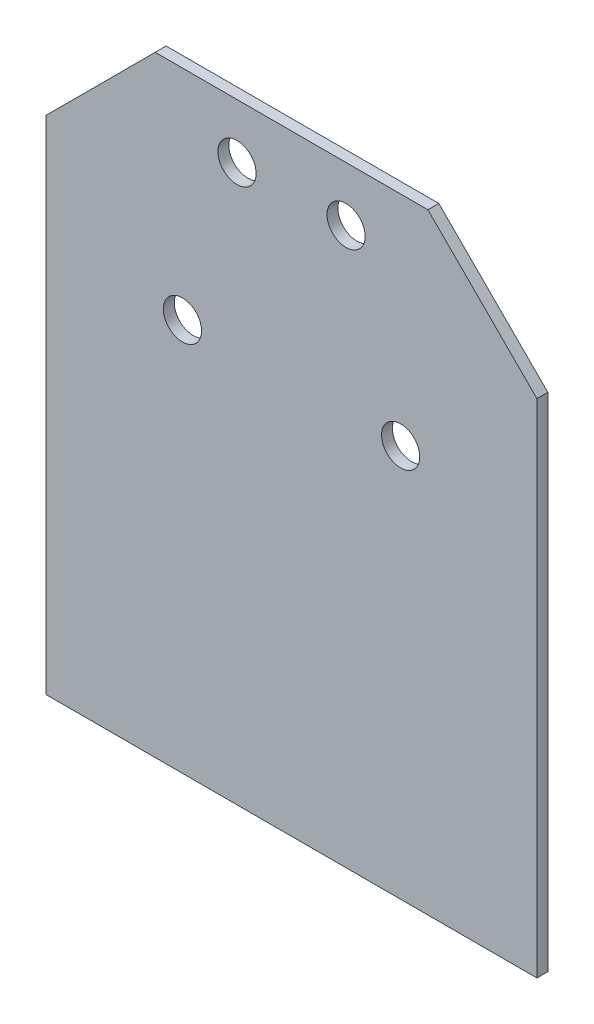
from build123d import *

# Parameters (mm, degrees)
SCHIZZO1_R                   = 1.75
ESTRUSIONE_ESTRUSIONE1_DEPTH = 1


with BuildPart() as part:
    # Schizzo1 → Estrusione-Estrusione1 (new body)
    with BuildSketch(Plane.XY):
        Polygon((-22.5, -42.291359792), (22.5, -42.291359792), (22.5, 3.708640208), (12.5, 13.708640208), (-12.5, 13.708640208), (-22.5, 3.708640208), align=None)
        with Locations((5, 8.708640208)):
            Circle(SCHIZZO1_R, mode=Mode.SUBTRACT)
        with Locations((-5, 8.708640208)):
            Circle(SCHIZZO1_R, mode=Mode.SUBTRACT)
        with Locations((10, -6.291359792)):
            Circle(SCHIZZO1_R, mode=Mode.SUBTRACT)
        with Locations((-10, -6.291359792)):
            Circle(SCHIZZO1_R, mode=Mode.SUBTRACT)
    extrude(amount=ESTRUSIONE_ESTRUSIONE1_DEPTH)


solid = part.part
